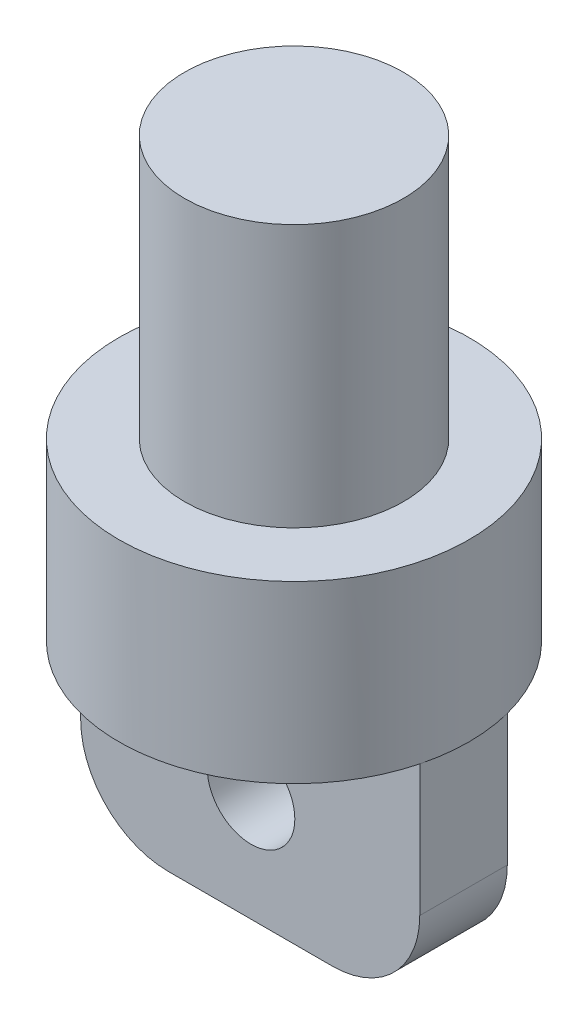
from build123d import *

# Parameters (mm, degrees)
SKETCH1_R           = 50.8
BOSS_EXTRUDE1_DEPTH = 50.8
SKETCH2_R           = 31.75
BOSS_EXTRUDE2_DEPTH = 76.2
SKETCH3_W           = 98.373776994
SKETCH3_H           = 25.4
BOSS_EXTRUDE3_DEPTH = 63.5
SKETCH4_R           = 12.7
CUT_EXTRUDE1_DEPTH  = 151.804144505
FILLET1_R           = 25.4
FILLET2_R           = 25.4


with BuildPart() as part:
    # Sketch1 → Boss-Extrude1 (new body)
    with BuildSketch(Plane(origin=(0, 0, 0), x_dir=(1, 0, 0), z_dir=(0, 1, 0))):
        with Locations(Location((0, 0, 0), (0, 0, 270))):
            Circle(SKETCH1_R)
    extrude(amount=BOSS_EXTRUDE1_DEPTH)

    # Sketch2 → Boss-Extrude2 (add)
    with BuildSketch(Plane(origin=(0, 50.8, 0), x_dir=(1, 0, 0), z_dir=(0, 1, 0))):
        with Locations(Location((0, 0, 0), (0, 0, 90))):
            Circle(SKETCH2_R)
    extrude(amount=BOSS_EXTRUDE2_DEPTH)

    # Sketch3 → Boss-Extrude3 (add)
    with BuildSketch(Plane.XZ):
        Rectangle(SKETCH3_W, SKETCH3_H)
    extrude(amount=BOSS_EXTRUDE3_DEPTH)

    # Sketch4 → Cut-Extrude1 (cut, through all)
    with BuildSketch(Plane.XY.offset(12.7)):
        with Locations((0.243990196, -31.967064289)):
            Circle(SKETCH4_R)
    extrude(amount=-CUT_EXTRUDE1_DEPTH, mode=Mode.SUBTRACT)

    # Fillet1
    fillet1_edges = [part.edges().sort_by_distance(p)[0] for p in [
        (-49.186888497, -63.5, 0),
    ]]
    fillet(fillet1_edges, radius=FILLET1_R)

    # Fillet2
    fillet2_edges = [part.edges().sort_by_distance(p)[0] for p in [
        (49.186888497, -63.5, 0),
    ]]
    fillet(fillet2_edges, radius=FILLET2_R)


solid = part.part
